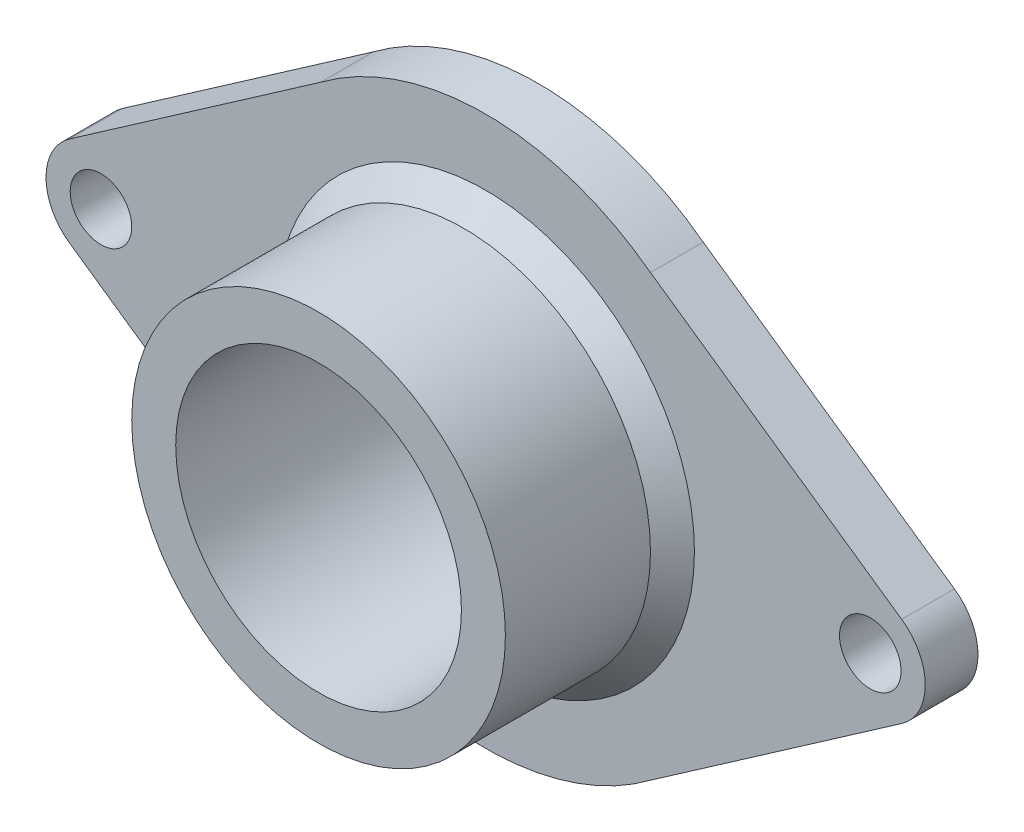
from build123d import *

# Parameters (mm, degrees)
SKETCH1_R               = 42.5
SKETCH1_R_2             = 32.5
BOSS_EXTRUDE1_DEPTH     = 50
SKETCH2_R               = 42.5
BOSS_EXTRUDE2_DEPTH     = 12
CUT_EXTRUDE1_DEPTH      = 129.086884575
CUT_EXTRUDE1_DEPTH_BACK = 129.086884575
SKETCH3_R               = 7
CHAMFER1_SIZE           = 5


with BuildPart() as part:
    # Sketch1 → Boss-Extrude1 (new body)
    with BuildSketch(Plane.XY):
        Circle(SKETCH1_R)
        Circle(SKETCH1_R_2, mode=Mode.SUBTRACT)
    extrude(amount=BOSS_EXTRUDE1_DEPTH)

    # Sketch2 → Boss-Extrude2 (add)
    with BuildSketch(Plane(origin=(0, 0, 0), x_dir=(-1, 0, 0), z_dir=(0, 0, -1))):
        with BuildLine():
            Line((-37.500000001, -49.999999999), (-94.637131817, -10.262131817))
            ThreePointArc((-94.637131817, -10.262131817), (-100, 0), (-94.637131817, 10.262131817))
            Line((-94.637131817, 10.262131817), (-37.500000001, 49.999999999))
            ThreePointArc((-37.500000001, 49.999999999), (0, 62.5), (37.500000001, 49.999999999))
            Line((37.500000001, 49.999999999), (94.637131817, 10.262131817))
            ThreePointArc((94.637131817, 10.262131817), (100, 0), (94.637131817, -10.262131817))
            Line((94.637131817, -10.262131817), (37.500000001, -49.999999999))
            ThreePointArc((37.500000001, -49.999999999), (0, -62.5), (-37.500000001, -49.999999999))
        make_face()
        Circle(SKETCH2_R, mode=Mode.SUBTRACT)
    extrude(amount=-BOSS_EXTRUDE2_DEPTH)

    # Sketch3 → Cut-Extrude1 (cut, two sides: drawn at the far end of the back side and taken through both)
    with BuildSketch(Plane(origin=(0, 0, 0), x_dir=(-1, 0, 0), z_dir=(0, 0, -1)).offset(-CUT_EXTRUDE1_DEPTH_BACK)):
        with Locations((87.5, 0)):
            Circle(SKETCH3_R)
        with Locations((-87.5, 0)):
            Circle(SKETCH3_R)
    extrude(amount=CUT_EXTRUDE1_DEPTH + CUT_EXTRUDE1_DEPTH_BACK, mode=Mode.SUBTRACT)

    # Chamfer1
    chamfer1_edges = [part.edges().sort_by_distance(p)[0] for p in [
        (-42.5, 0, 12),
    ]]
    chamfer(chamfer1_edges, length=CHAMFER1_SIZE)


solid = part.part
